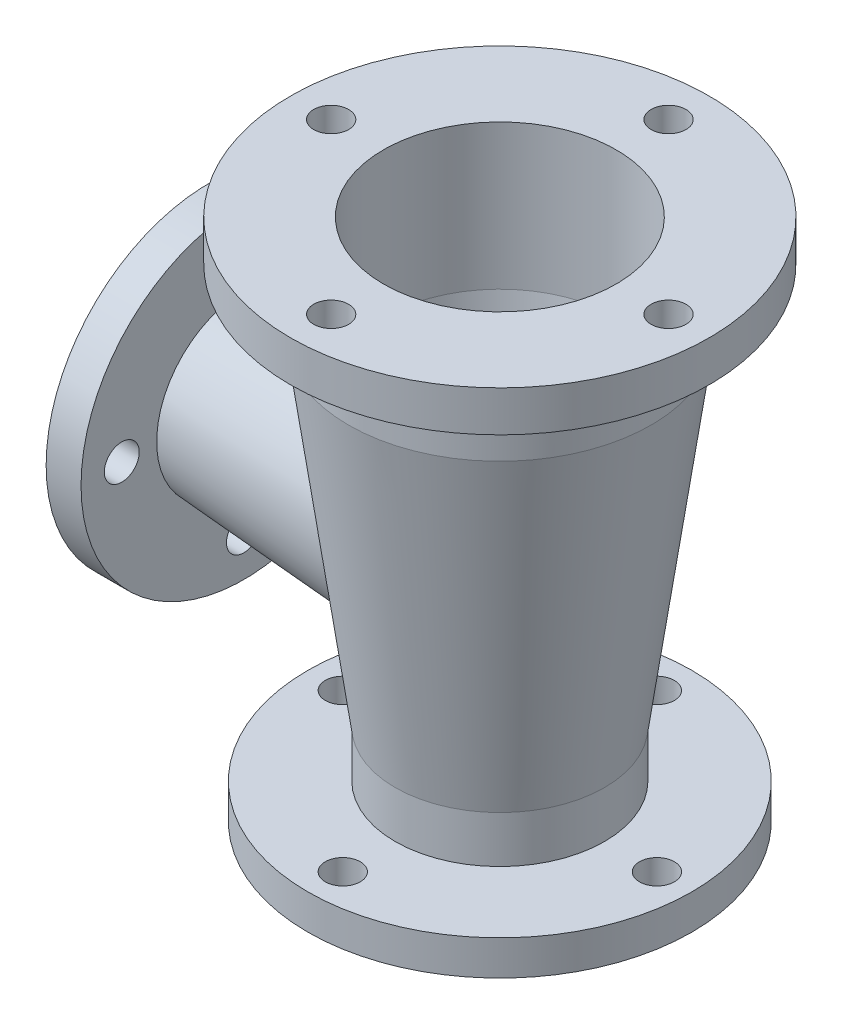
from build123d import *

# Parameters (mm, degrees)
SKETCH2_R          = 6
CUT_EXTRUDE1_DEPTH = 108
SKETCH3_R          = 6
CUT_EXTRUDE2_DEPTH = 108
SKETCH7_R          = 6
CUT_EXTRUDE3_DEPTH = 25


with BuildPart() as part:
    # Sketch1 → Revolve1 (revolve)
    with BuildSketch(Plane.XY, mode=Mode.PRIVATE) as revolve1_sk:
        with BuildLine():
            Line((40, 125.226737055), (72, 125.226737055))
            Line((72, 125.226737055), (72, 111.226737055))
            Line((72, 111.226737055), (52, 111.226737055))
            Line((52, 111.226737055), (52, 89.226737055))
            Line((52, 89.226737055), (36, -26.705850917))
            Line((36, -26.705850917), (36, -42.773262945))
            Line((36, -42.773262945), (66, -42.773262945))
            Line((66, -42.773262945), (66, -54.773262945))
            Line((66, -54.773262945), (20, -54.773262945))
            Line((20, -54.773262945), (20, -18.773262945))
            Line((20, -18.773262945), (22.642663047, -18.773262945))
            ThreePointArc((22.642663047, -18.773262945), (25.927637621, -17.542737981), (27.595714907, -14.456839764))
            Line((27.595714907, -14.456839764), (40, 75.421964782))
            Line((40, 75.421964782), (40, 125.226737055))
        make_face()
    revolve(revolve1_sk.sketch.rotate(Axis((0, 125.226737055, 0), (0, -1, 0)), 90), axis=Axis((0, 125.226737055, 0), (0, -1, 0)))

    # Sketch2 → Cut-Extrude1 (cut)
    with BuildSketch(Plane(origin=(0, -42.773262945, 0), x_dir=(1, 0, 0), z_dir=(0, 1, 0))):
        with Locations(Location((0, 54, 0), (0, 0, 270))):
            Circle(SKETCH2_R)
        with Locations(Location((54, 0, 0), (0, 0, 270))):
            Circle(SKETCH2_R)
        with Locations(Location((0, -54, 0), (0, 0, 270))):
            Circle(SKETCH2_R)
        with Locations(Location((-54, 0, 0), (0, 0, 270))):
            Circle(SKETCH2_R)
    extrude(amount=-CUT_EXTRUDE1_DEPTH, mode=Mode.SUBTRACT)

    # Sketch3 → Cut-Extrude2 (cut)
    with BuildSketch(Plane(origin=(0, 125.226737055, 0), x_dir=(1, 0, 0), z_dir=(0, 1, 0))):
        with Locations(Location((0, 58, 0), (0, 0, 270))):
            Circle(SKETCH3_R)
        with Locations(Location((58, 0, 0), (0, 0, 270))):
            Circle(SKETCH3_R)
        with Locations(Location((0, -58, 0), (0, 0, 270))):
            Circle(SKETCH3_R)
        with Locations(Location((-58, 0, 0), (0, 0, 270))):
            Circle(SKETCH3_R)
    extrude(amount=-CUT_EXTRUDE2_DEPTH, mode=Mode.SUBTRACT)

    # Sketch4 → Revolve2 (revolve)
    with BuildSketch(Plane.XY, mode=Mode.PRIVATE) as revolve2_sk:
        Polygon((-100, 29.226737055), (-100, 85.226737055), (-88, 85.226737055), (-88, 59.226737055), (0, 65.226737055), (0, 29.226737055), align=None)
    revolve(revolve2_sk.sketch.rotate(Axis((0, 29.226737055, 0), (-1, 0, 0)), 90), axis=Axis((0, 29.226737055, 0), (-1, 0, 0)))

    # Sketch5 → Cut-Revolve2 (revolve, cut)
    with BuildSketch(Plane.XY):
        Polygon((0, 111.226737055), (40, 111.226737055), (40, 75.421964782), (27.5, -14.456839764), (0, -14.456839764), align=None)
    revolve(axis=Axis((0, 125.226737055, 0), (0, -1, 0)), mode=Mode.SUBTRACT)

    # Sketch6 → Cut-Revolve3 (revolve, cut)
    with BuildSketch(Plane.XY, mode=Mode.PRIVATE) as cut_revolve3_sk:
        Polygon((0, 29.226737055), (-100, 29.226737055), (-100, 49.226737055), (0, 55.226737055), align=None)
    revolve(cut_revolve3_sk.sketch.rotate(Axis((0, 29.226737055, 0), (-1, 0, 0)), 90), axis=Axis((0, 29.226737055, 0), (-1, 0, 0)), mode=Mode.SUBTRACT)

    # Sketch7 → Cut-Extrude3 (cut)
    with BuildSketch(Plane.ZY.offset(100)):
        with Locations((0, 71.226737055)):
            Circle(SKETCH7_R)
        with Locations((42, 29.226737055)):
            Circle(SKETCH7_R)
        with Locations((0, -12.773262945)):
            Circle(SKETCH7_R)
        with Locations((-42, 29.226737055)):
            Circle(SKETCH7_R)
    extrude(amount=-CUT_EXTRUDE3_DEPTH, mode=Mode.SUBTRACT)


solid = part.part
